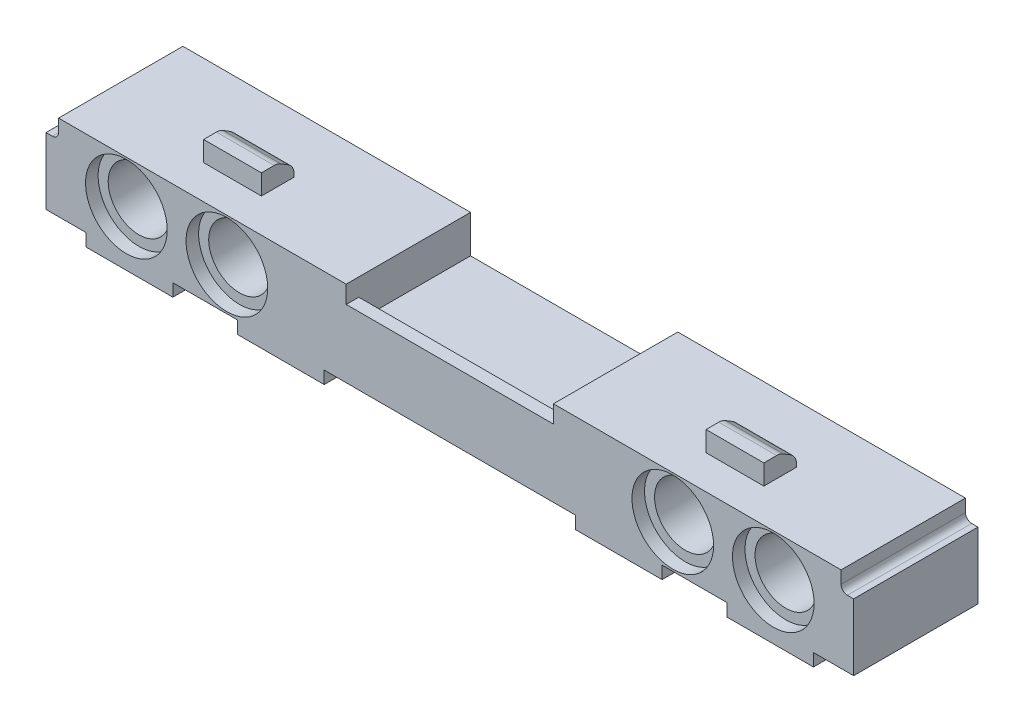
from build123d import *

# Parameters (mm, degrees)
SKETCH1_W           = 64.3
SKETCH1_H           = 6.8
SKETCH1_R           = 2.45
BOSS_EXTRUDE2_DEPTH = 9.9
SKETCH2_R           = 3.25
CUT_EXTRUDE1_DEPTH  = 2.9
CUT_EXTRUDE2_DEPTH  = 11
SKETCH7_W           = 6.9
SKETCH7_H           = 1
BOSS_EXTRUDE3_DEPTH = 9.9
SKETCH8_W           = 16.5
SKETCH8_H           = 6
CUT_EXTRUDE3_DEPTH  = 12
SKETCH9_W           = 16.5
SKETCH9_H           = 1.6
BOSS_EXTRUDE4_DEPTH = 1
SKETCH10_W          = 4.6
SKETCH10_H          = 2.6
BOSS_EXTRUDE5_DEPTH = 1.6
CUT_EXTRUDE4_REACH  = 57.568
FILLET1_R           = 1
CUT_EXTRUDE6_START  = -1
SKETCH13_R          = 3.25
CUT_EXTRUDE6_DEPTH  = 1


with BuildPart() as part:
    # Sketch1 → Boss-Extrude2 (new body)
    with BuildSketch(Plane.XY):
        Rectangle(SKETCH1_W, SKETCH1_H)
        with Locations(Location((-17.75, 0, 0), (0, 0, 180))):
            Circle(SKETCH1_R, mode=Mode.SUBTRACT)
        with Locations(Location((-25.75, 0, 0), (0, 0, 180))):
            Circle(SKETCH1_R, mode=Mode.SUBTRACT)
        with Locations(Location((17.75, 0, 0), (0, 0, 180))):
            Circle(SKETCH1_R, mode=Mode.SUBTRACT)
        with Locations(Location((25.75, 0, 0), (0, 0, 180))):
            Circle(SKETCH1_R, mode=Mode.SUBTRACT)
    extrude(amount=BOSS_EXTRUDE2_DEPTH)

    # Sketch2 → Cut-Extrude1 (cut)
    with BuildSketch(Plane(origin=(0, 0, 0), x_dir=(-1, 0, 0), z_dir=(0, 0, -1))):
        with Locations((-25.75, 0)):
            Circle(SKETCH2_R)
        with Locations((-17.75, 0)):
            Circle(SKETCH2_R)
        with Locations(Location((17.75, 0, 0), (0, 0, 180))):
            Circle(SKETCH2_R)
        with Locations(Location((25.75, 0, 0), (0, 0, 180))):
            Circle(SKETCH2_R)
    extrude(amount=-CUT_EXTRUDE1_DEPTH, mode=Mode.SUBTRACT)

    # Sketch5 → Cut-Extrude2 (cut)
    with BuildSketch(Plane.XY.offset(9.9)):
        with BuildLine():
            Line((32.15, 3.4), (31.15, 3.4))
            Line((31.15, 3.4), (31.15, 2.4))
            ThreePointArc((31.15, 2.4), (31.296446609, 2.046446609), (31.65, 1.9))
            Line((31.65, 1.9), (32.15, 1.9))
            Line((32.15, 1.9), (32.15, 3.4))
        make_face()
        with BuildLine():
            Line((-32.15, 3.4), (-32.15, 1.9))
            Line((-32.15, 1.9), (-31.65, 1.9))
            ThreePointArc((-31.65, 1.9), (-31.296446609, 2.046446609), (-31.15, 2.4))
            Line((-31.15, 2.4), (-31.15, 3.4))
            Line((-31.15, 3.4), (-32.15, 3.4))
        make_face()
    extrude(amount=-CUT_EXTRUDE2_DEPTH, mode=Mode.SUBTRACT)

    # Sketch7 → Boss-Extrude3 (add)
    with BuildSketch(Plane.XY.offset(9.9)):
        with Locations((-25.5, -3.9)):
            Rectangle(SKETCH7_W, SKETCH7_H)
        with Locations((-13.45, -3.9)):
            Rectangle(SKETCH7_W, SKETCH7_H)
        with Locations((13.45, -3.9)):
            Rectangle(SKETCH7_W, SKETCH7_H)
        with Locations((25.5, -3.9)):
            Rectangle(SKETCH7_W, SKETCH7_H)
    extrude(amount=-BOSS_EXTRUDE3_DEPTH)

    # Sketch8 → Cut-Extrude3 (cut)
    with BuildSketch(Plane.XY.offset(9.9)):
        with Locations((0, 3.4)):
            Rectangle(SKETCH8_W, SKETCH8_H)
    extrude(amount=-CUT_EXTRUDE3_DEPTH, mode=Mode.SUBTRACT)

    # Sketch9 → Boss-Extrude4 (add)
    with BuildSketch(Plane.XY.offset(9.9)):
        with Locations((0, 1.2)):
            Rectangle(SKETCH9_W, SKETCH9_H)
    extrude(amount=-BOSS_EXTRUDE4_DEPTH)

    # Sketch10 → Boss-Extrude5 (add)
    with BuildSketch(Plane(origin=(0, 3.4, 0), x_dir=(1, 0, 0), z_dir=(0, 1, 0))):
        with Locations((-20, -5.9)):
            Rectangle(SKETCH10_W, SKETCH10_H)
        with Locations((20, -5.9)):
            Rectangle(SKETCH10_W, SKETCH10_H)
    extrude(amount=BOSS_EXTRUDE5_DEPTH)

    # Cut-Extrude4: up to this face of the body (flat: up to its plane)
    cut_extrude4_end = Plane(part.part.faces().sort_by_distance((22.3, 4.2, 5.9))[0])
    # Sketch11 → Cut-Extrude4 (cut, up to the picked face)
    with BuildSketch(Plane.ZY.offset(22.3), mode=Mode.PRIVATE) as cut_extrude4_sk1:
        Polygon((4.6, 4.2), (5.9, 5), (4.6, 5), align=None)
    cut_extrude4_tool1 = split(extrude(cut_extrude4_sk1.sketch, amount=-CUT_EXTRUDE4_REACH, mode=Mode.PRIVATE), bisect_by=cut_extrude4_end, keep=Keep.BOTH, mode=Mode.PRIVATE)
    add(cut_extrude4_tool1.solids().sort_by(Axis((-22.3, 4.733333, 5.033333), (1, 0, 0)))[0], mode=Mode.SUBTRACT)

    # Fillet1
    fillet1_edges = [part.edges().sort_by_distance(p)[0] for p in [
        (-20, 5, 5.9),
        (-20, 4.2, 4.6),
        (20, 5, 5.9),
        (20, 4.2, 4.6),
    ]]
    fillet(fillet1_edges, radius=FILLET1_R)

    # Sketch13 → Cut-Extrude6 (cut)
    with BuildSketch(Plane.XY.offset(9.9).offset(CUT_EXTRUDE6_START)):
        with Locations((-25.75, 0)):
            Circle(SKETCH13_R)
        with Locations((-17.75, 0)):
            Circle(SKETCH13_R)
        with Locations(Location((25.75, 0, 0), (0, 0, 180))):
            Circle(SKETCH13_R)
        with Locations(Location((17.75, 0, 0), (0, 0, 180))):
            Circle(SKETCH13_R)
    extrude(amount=CUT_EXTRUDE6_DEPTH, mode=Mode.SUBTRACT)


solid = part.part
